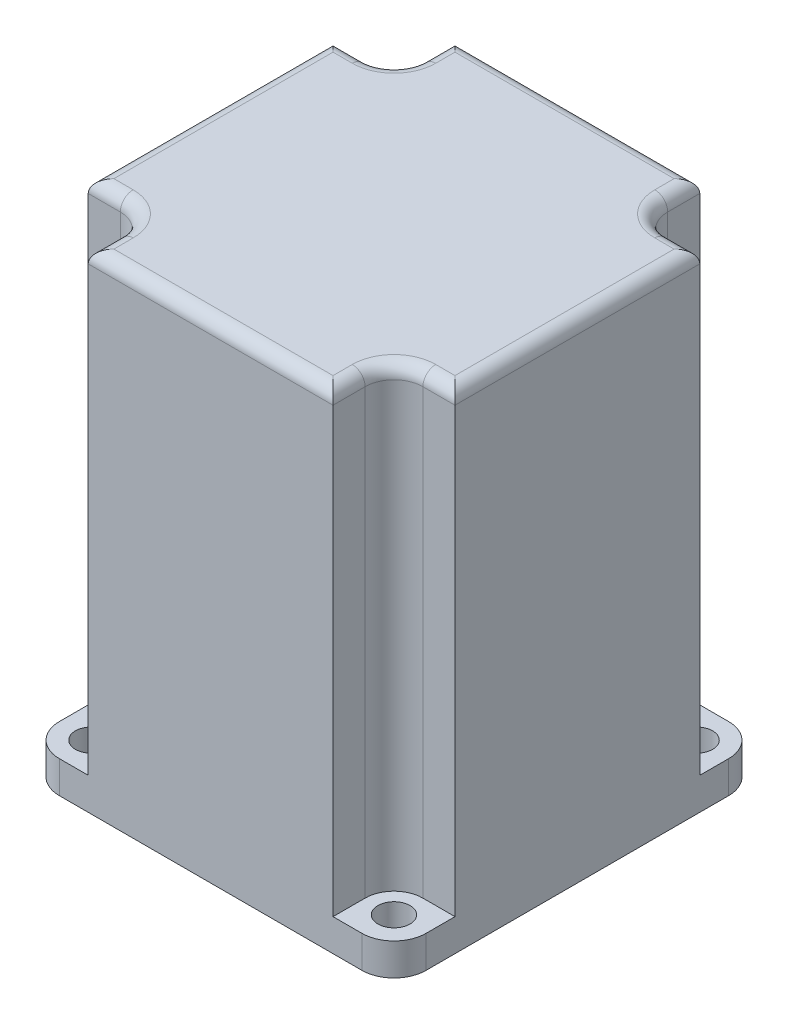
from build123d import *

# Parameters (mm, degrees)
SZKIC1_W                    = 57.14
SZKIC1_H                    = 57.14
SZKIC1_R                    = 2.5
DODANIE_WYCI_GNI_CIE1_DEPTH = 5
DODANIE_WYCI_GNI_CIE2_DEPTH = 71
ZAOKR_GLENIE1_R             = 2
SZKIC3_R                    = 4
DODANIE_WYCI_GNI_CIE3_DEPTH = 20.6
ZAOKR_GLENIE2_R             = 5


with BuildPart() as part:
    # Szkic1 → Dodanie-wyciągnięcie1 (new body)
    with BuildSketch(Plane(origin=(0, 0, 0), x_dir=(1, 0, 0), z_dir=(0, 1, 0))):
        Rectangle(SZKIC1_W, SZKIC1_H)
        with Locations(Location((-23.57, 23.57, 0), (0, 0, 270))):
            Circle(SZKIC1_R, mode=Mode.SUBTRACT)
        with Locations(Location((23.57, 23.57, 0), (0, 0, 270))):
            Circle(SZKIC1_R, mode=Mode.SUBTRACT)
        with Locations(Location((23.57, -23.57, 0), (0, 0, 270))):
            Circle(SZKIC1_R, mode=Mode.SUBTRACT)
        with Locations(Location((-23.57, -23.57, 0), (0, 0, 270))):
            Circle(SZKIC1_R, mode=Mode.SUBTRACT)
    extrude(amount=DODANIE_WYCI_GNI_CIE1_DEPTH)

    # Szkic2 → Dodanie-wyciągnięcie2 (add)
    with BuildSketch(Plane(origin=(0, 5, 0), x_dir=(1, 0, 0), z_dir=(0, 1, 0))):
        with BuildLine():
            ThreePointArc((-19.07, 23.57), (-20.388019485, 20.388019485), (-23.57, 19.07))
            Line((-23.57, 19.07), (-28.57, 19.07))
            Line((-28.57, 19.07), (-28.57, -19.07))
            Line((-28.57, -19.07), (-23.57, -19.07))
            ThreePointArc((-23.57, -19.07), (-20.388019485, -20.388019485), (-19.07, -23.57))
            Line((-19.07, -23.57), (-19.07, -28.57))
            Line((-19.07, -28.57), (19.07, -28.57))
            Line((19.07, -28.57), (19.07, -23.57))
            ThreePointArc((19.07, -23.57), (20.388019485, -20.388019485), (23.57, -19.07))
            Line((23.57, -19.07), (28.57, -19.07))
            Line((28.57, -19.07), (28.57, 19.07))
            Line((28.57, 19.07), (23.57, 19.07))
            ThreePointArc((23.57, 19.07), (20.388019485, 20.388019485), (19.07, 23.57))
            Line((19.07, 23.57), (19.07, 28.57))
            Line((19.07, 28.57), (-19.07, 28.57))
            Line((-19.07, 28.57), (-19.07, 23.57))
        make_face()
    extrude(amount=DODANIE_WYCI_GNI_CIE2_DEPTH)

    # Zaokrąglenie1
    zaokr_glenie1_edges = [part.edges().sort_by_distance(p)[0] for p in [
        (19.07, 76, 26.07),
        (0, 76, 28.57),
        (-19.07, 76, 26.07),
        (-20.388019485, 76, 20.388019485),
        (-26.07, 76, 19.07),
        (-28.57, 76, 0),
        (-26.07, 76, -19.07),
        (-20.388019485, 76, -20.388019485),
        (-19.07, 76, -26.07),
        (0, 76, -28.57),
        (19.07, 76, -26.07),
        (20.388019485, 76, -20.388019485),
        (26.07, 76, -19.07),
        (28.57, 76, 0),
        (26.07, 76, 19.07),
        (20.388019485, 76, 20.388019485),
    ]]
    fillet(zaokr_glenie1_edges, radius=ZAOKR_GLENIE1_R)

    # Szkic3 → Dodanie-wyciągnięcie3 (add)
    with BuildSketch(Plane(origin=(0, 0, 0), x_dir=(-1, 0, 0), z_dir=(0, -1, 0))):
        with Locations(Location((0, 0, 0), (0, 0, 270))):
            Circle(SZKIC3_R)
    extrude(amount=DODANIE_WYCI_GNI_CIE3_DEPTH)

    # Zaokrąglenie2
    zaokr_glenie2_edges = [part.edges().sort_by_distance(p)[0] for p in [
        (-28.57, 2.5, -28.57),
        (28.57, 2.5, -28.57),
        (28.57, 2.5, 28.57),
        (-28.57, 2.5, 28.57),
    ]]
    fillet(zaokr_glenie2_edges, radius=ZAOKR_GLENIE2_R)


solid = part.part
